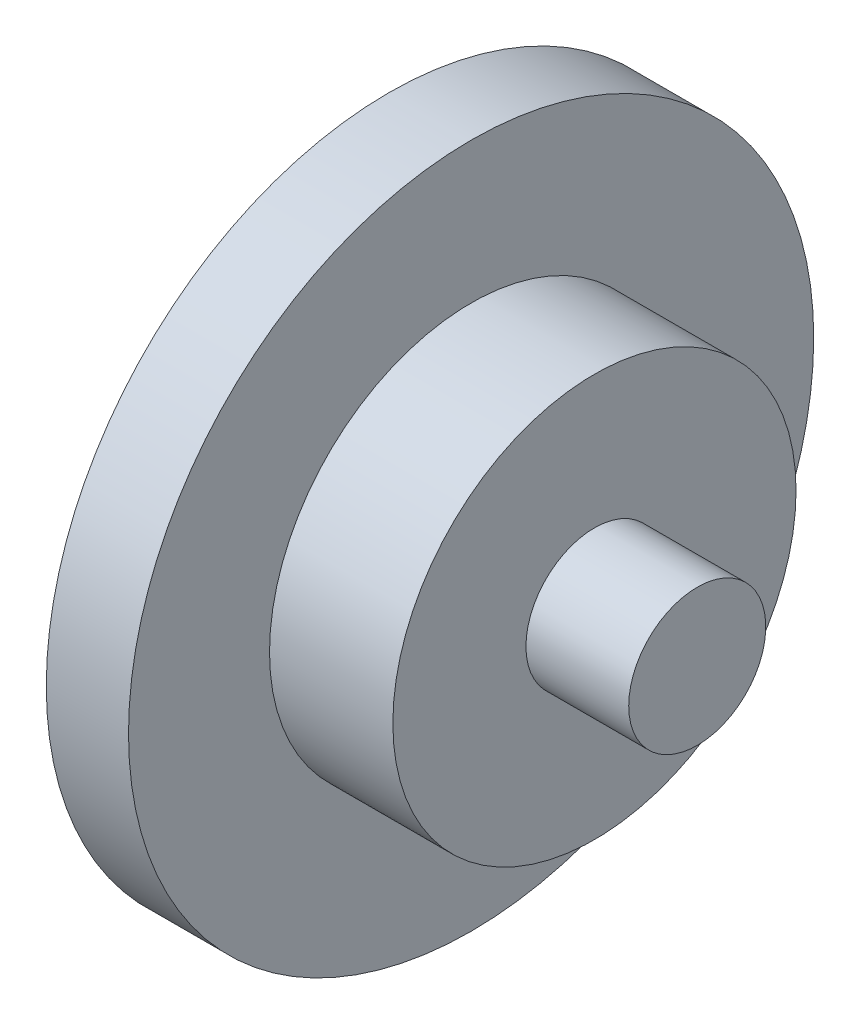
from build123d import *


with BuildPart() as part:
    # Sketch1 → Revolve1 (revolve)
    with BuildSketch(Plane.XY, mode=Mode.PRIVATE) as revolve1_sk:
        Polygon((0, 10), (-15, 10), (-15, 29.421221865), (-33, 29.421221865), (-33, 50), (-45, 50), (-45, 0), (0, 0), align=None)
    revolve(revolve1_sk.sketch.rotate(Axis((-45, 0, 0), (1, 0, 0)), 90), axis=Axis((-45, 0, 0), (1, 0, 0)))


solid = part.part
